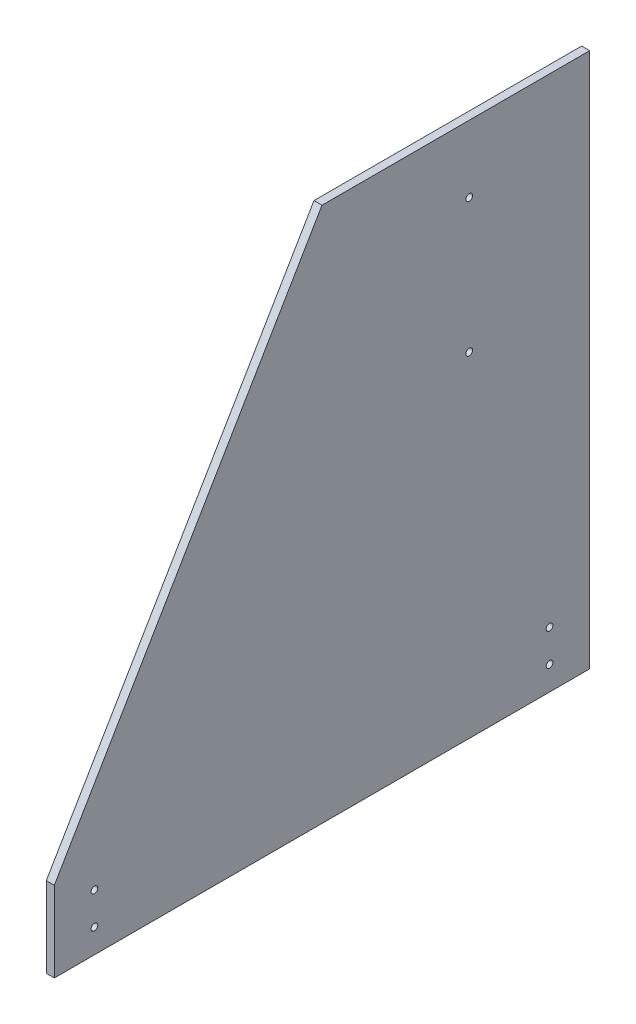
from build123d import *

# Parameters (mm, degrees)
SKETCH1_R           = 2.5
BOSS_EXTRUDE1_DEPTH = 6


with BuildPart() as part:
    # Sketch1 → Boss-Extrude1 (new body)
    with BuildSketch(Plane(origin=(0, 0, 0), x_dir=(0, 0, -1), z_dir=(1, 0, 0))):
        Polygon((0, 0), (400, 0), (400, 400), (200, 400), (0, 60), align=None)
        with Locations((30, 42)):
            Circle(SKETCH1_R, mode=Mode.SUBTRACT)
        with Locations(Location((30, 18, 0), (0, 0, 180))):
            Circle(SKETCH1_R, mode=Mode.SUBTRACT)
        with Locations((370, 18)):
            Circle(SKETCH1_R, mode=Mode.SUBTRACT)
        with Locations(Location((370, 42, 0), (0, 0, 180))):
            Circle(SKETCH1_R, mode=Mode.SUBTRACT)
        with Locations((310, 350)):
            Circle(SKETCH1_R, mode=Mode.SUBTRACT)
        with Locations((310, 250)):
            Circle(SKETCH1_R, mode=Mode.SUBTRACT)
    extrude(amount=BOSS_EXTRUDE1_DEPTH)


solid = part.part
